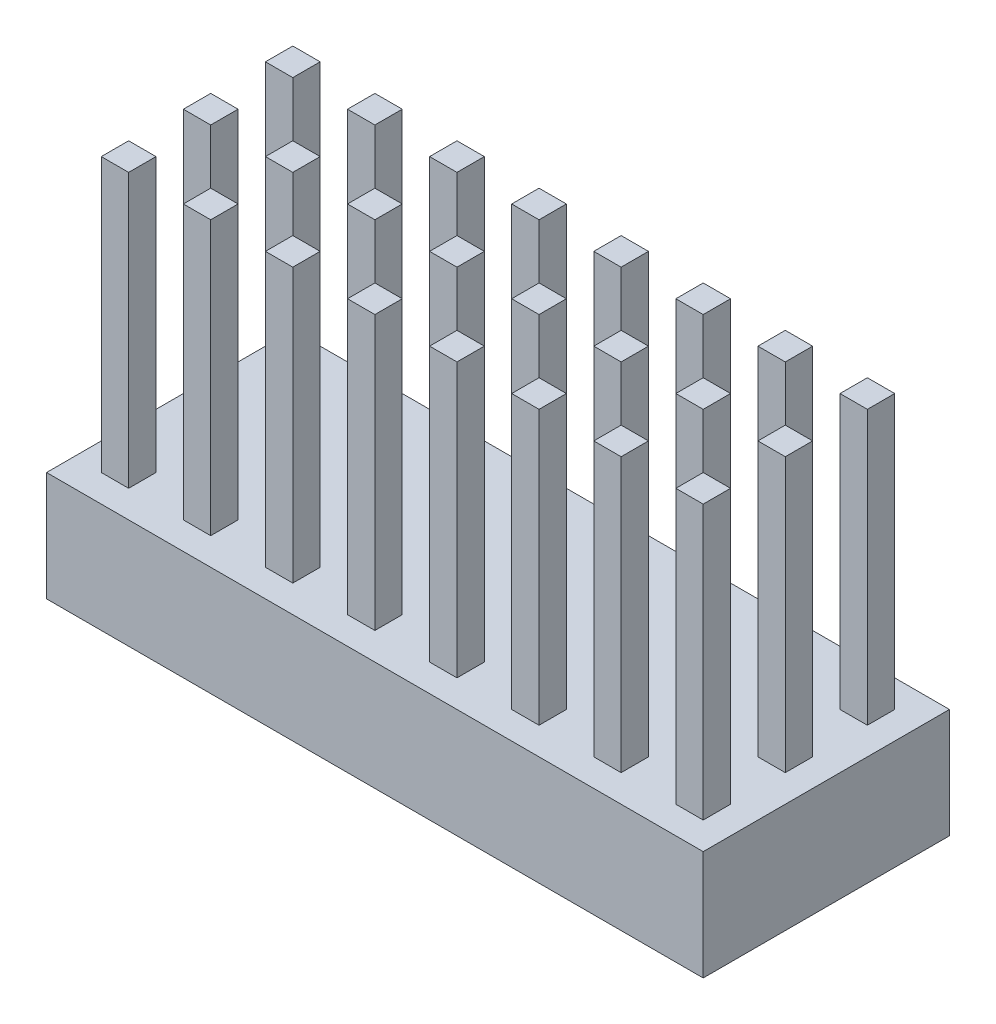
from build123d import *

# Parameters (mm, degrees)
SKETCH1_W      = 18.288
SKETCH1_H      = 6.858
EXTRUDE1_DEPTH = 3.048
SKETCH2_W      = 0.762
SKETCH2_H      = 0.762
EXTRUDE2_DEPTH = 7.62


with BuildPart() as part:
    # Sketch1 → Extrude1 (new body)
    with BuildSketch(Plane(origin=(0, 0, 0), x_dir=(1, 0, 0), z_dir=(0, 1, 0))):
        with Locations((9.144, 3.429)):
            Rectangle(SKETCH1_W, SKETCH1_H)
    extrude(amount=EXTRUDE1_DEPTH)

    # Sketch2 → Extrude2 (add)
    with BuildSketch(Plane(origin=(0, 3.048, 0), x_dir=(1, 0, 0), z_dir=(0, 1, 0))):
        with Locations((3.429, 5.715)):
            Rectangle(SKETCH2_W, SKETCH2_H)
        with Locations((1.143, 5.715)):
            Rectangle(SKETCH2_W, SKETCH2_H)
        with Locations((5.715, 5.715)):
            Rectangle(SKETCH2_W, SKETCH2_H)
        with Locations((8.001, 5.715)):
            Rectangle(SKETCH2_W, SKETCH2_H)
        with Locations((10.287, 5.715)):
            Rectangle(SKETCH2_W, SKETCH2_H)
        with Locations((12.573, 5.715)):
            Rectangle(SKETCH2_W, SKETCH2_H)
        with Locations((14.859, 5.715)):
            Rectangle(SKETCH2_W, SKETCH2_H)
        with Locations((17.145, 5.715)):
            Rectangle(SKETCH2_W, SKETCH2_H)
        with Locations((1.143, 3.429)):
            Rectangle(SKETCH2_W, SKETCH2_H)
        with Locations((3.429, 3.429)):
            Rectangle(SKETCH2_W, SKETCH2_H)
        with Locations((5.715, 3.429)):
            Rectangle(SKETCH2_W, SKETCH2_H)
        with Locations((8.001, 3.429)):
            Rectangle(SKETCH2_W, SKETCH2_H)
        with Locations((10.287, 3.429)):
            Rectangle(SKETCH2_W, SKETCH2_H)
        with Locations((12.573, 3.429)):
            Rectangle(SKETCH2_W, SKETCH2_H)
        with Locations((14.859, 3.429)):
            Rectangle(SKETCH2_W, SKETCH2_H)
        with Locations((17.145, 3.429)):
            Rectangle(SKETCH2_W, SKETCH2_H)
        with Locations((1.143, 1.143)):
            Rectangle(SKETCH2_W, SKETCH2_H)
        with Locations((3.429, 1.143)):
            Rectangle(SKETCH2_W, SKETCH2_H)
        with Locations((5.715, 1.143)):
            Rectangle(SKETCH2_W, SKETCH2_H)
        with Locations((8.001, 1.143)):
            Rectangle(SKETCH2_W, SKETCH2_H)
        with Locations((10.287, 1.143)):
            Rectangle(SKETCH2_W, SKETCH2_H)
        with Locations((12.573, 1.143)):
            Rectangle(SKETCH2_W, SKETCH2_H)
        with Locations((14.859, 1.143)):
            Rectangle(SKETCH2_W, SKETCH2_H)
        with Locations((17.145, 1.143)):
            Rectangle(SKETCH2_W, SKETCH2_H)
    extrude(amount=EXTRUDE2_DEPTH)


solid = part.part
